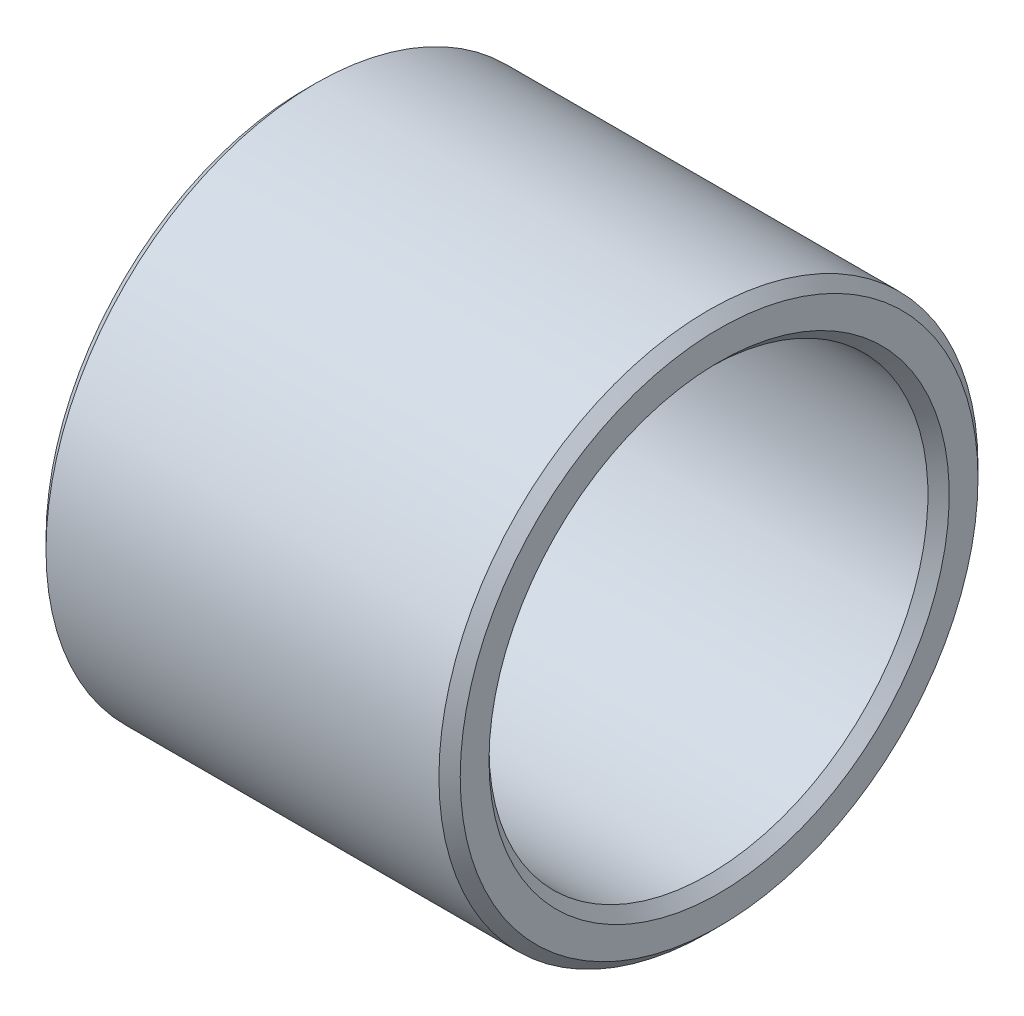
from build123d import *


with BuildPart() as part:
    # Esquisse1 → Révolution1 (revolve)
    with BuildSketch(Plane.XY, mode=Mode.PRIVATE) as r_volution1_sk:
        Polygon((0, 12.15), (0.5, 12.65), (18.94, 12.65), (19.44, 12.15), (19.44, 10.8), (18.94, 10.3), (0.5, 10.3), (0, 10.8), align=None)
    revolve(r_volution1_sk.sketch.rotate(Axis((-10.655084746, 0, 0), (1, 0, 0)), 90), axis=Axis((-10.655084746, 0, 0), (1, 0, 0)))


solid = part.part
